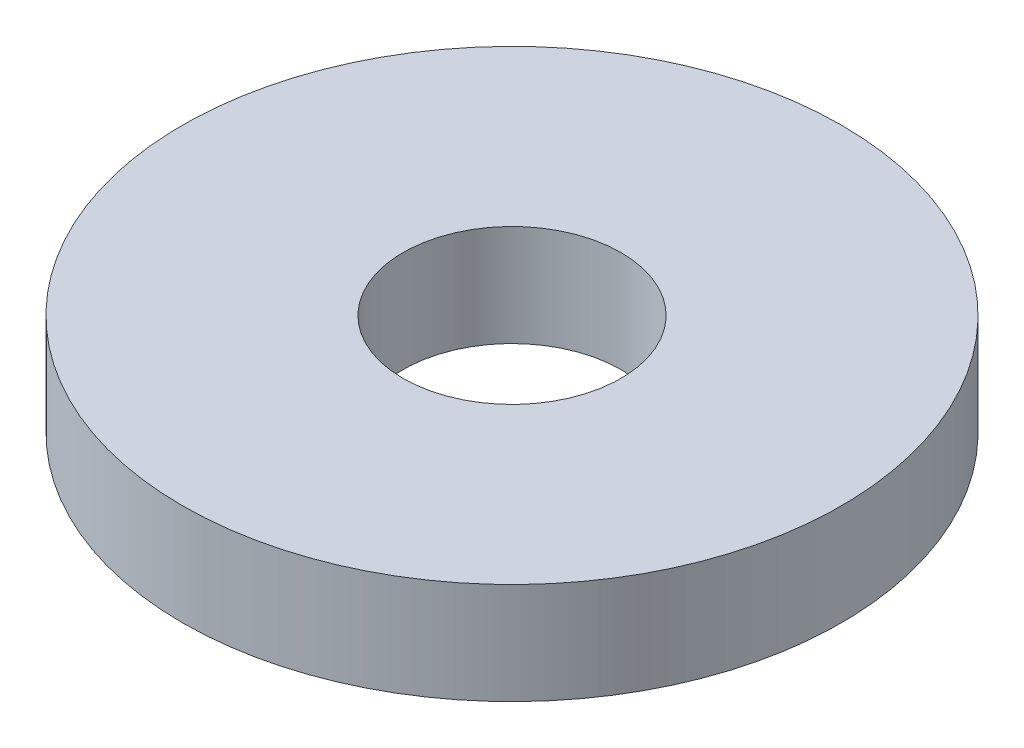
from build123d import *

# Parameters (mm, degrees)
SKETCH1_R           = 6.5
SKETCH1_R_2         = 2.15
BOSS_EXTRUDE1_DEPTH = 2


with BuildPart() as part:
    # Sketch1 → Boss-Extrude1 (new body)
    with BuildSketch(Plane(origin=(0, 0, 0), x_dir=(1, 0, 0), z_dir=(0, 1, 0))):
        with Locations(Location((0, 0, 0), (0, 0, 270))):
            Circle(SKETCH1_R)
        with Locations(Location((0, 0, 0), (0, 0, 270))):
            Circle(SKETCH1_R_2, mode=Mode.SUBTRACT)
    extrude(amount=BOSS_EXTRUDE1_DEPTH)


solid = part.part
